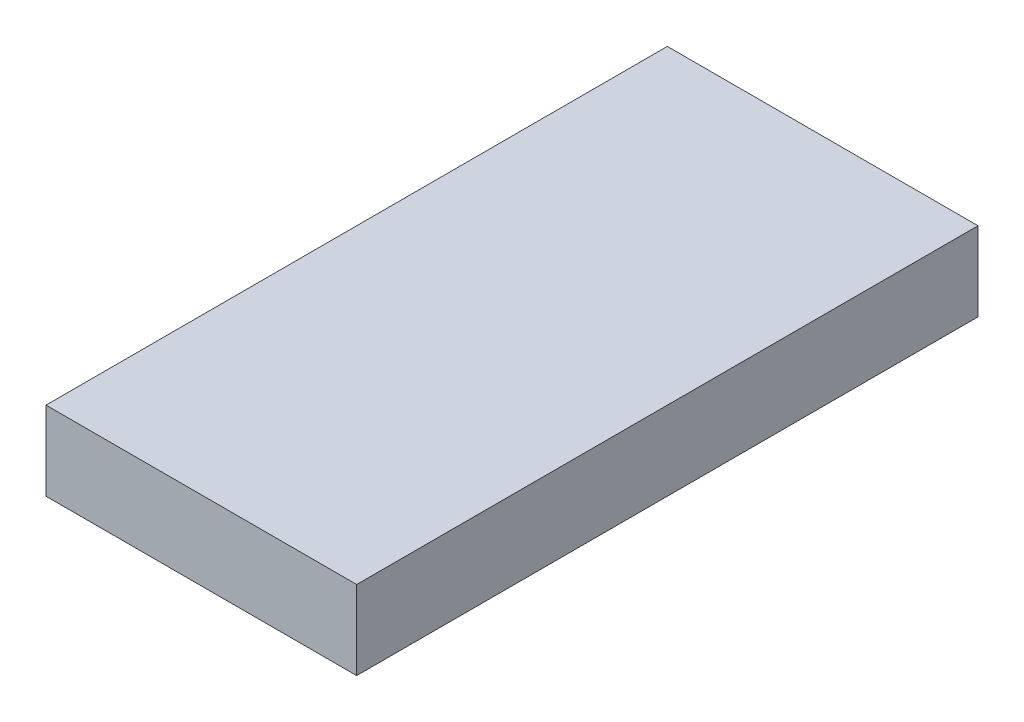
from build123d import *

# Parameters (mm, degrees)
SKETCH1_W           = 25
SKETCH1_H           = 50
BOSS_EXTRUDE1_DEPTH = 6.35


with BuildPart() as part:
    # Sketch1 → Boss-Extrude1 (new body)
    with BuildSketch(Plane(origin=(0, 0, 0), x_dir=(1, 0, 0), z_dir=(0, 1, 0))):
        with Locations((12.5, -25)):
            Rectangle(SKETCH1_W, SKETCH1_H)
    extrude(amount=BOSS_EXTRUDE1_DEPTH)


solid = part.part
